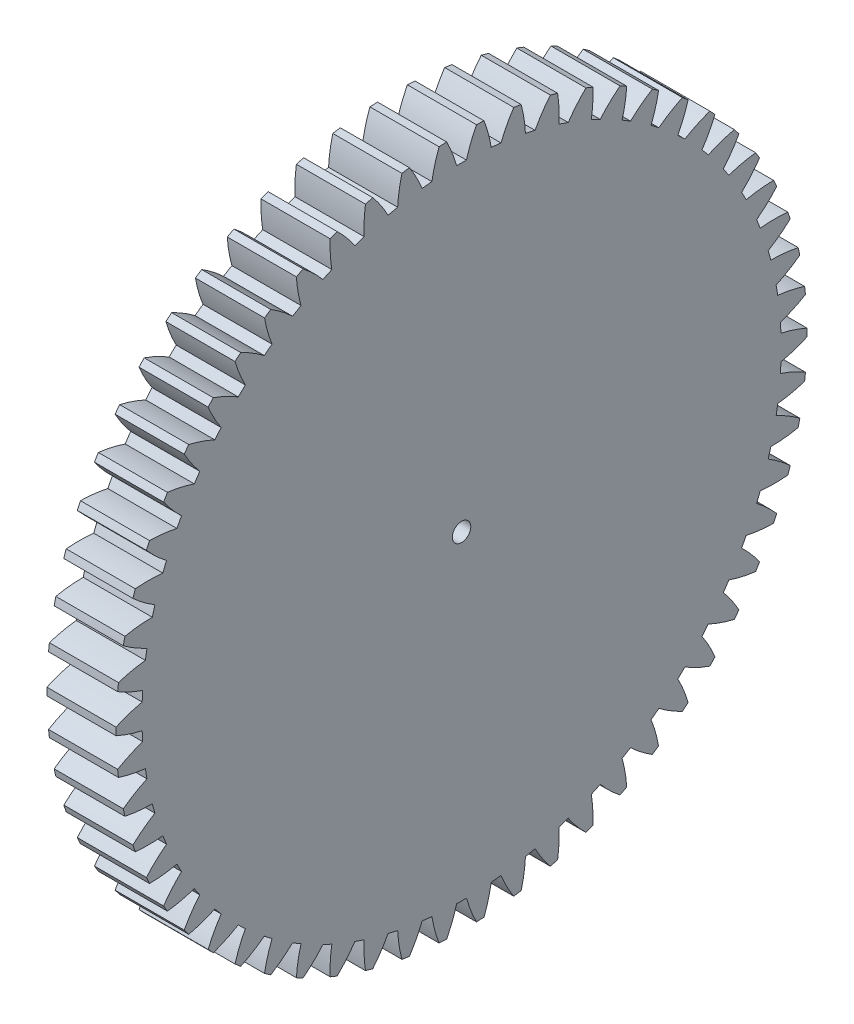
from build123d import *

# Parameters (mm, degrees)
BASPROSKE_W     = 15
BASPROSKE_H     = 75
TOOTHCUT_DEPTH  = 108.121426428
TEETHCUTS_COUNT = 58
TEETHCUTS_ANGLE = 353.793103448
BORSKE_R        = 2
BORE_DEPTH      = 50.0000508


with BuildPart() as part:
    # BasProSke → Base-Revolve (revolve)
    with BuildSketch(Plane(origin=(0, 0, 0), x_dir=(1, 0, 0), z_dir=(0, 1, 0)), mode=Mode.PRIVATE) as base_revolve_sk:
        with Locations((7.5, 37.5)):
            Rectangle(BASPROSKE_W, BASPROSKE_H)
    revolve(base_revolve_sk.sketch.rotate(Axis((-10, 0, 0), (1, 0, 0)), 180), axis=Axis((-10, 0, 0), (1, 0, 0)))

    # TooCutSke → ToothCut (cut, through all)
    with BuildSketch(Plane(origin=(0, 0, 0), x_dir=(0, 0, -1), z_dir=(1, 0, 0))):
        with BuildLine():
            ThreePointArc((1.065657476, 69.365814708), (0, 69.374), (-1.065657476, 69.365814708))
            ThreePointArc((-1.065657476, 69.365814708), (-2.015396246, 72.217083393), (-3.25511677, 74.954752084))
            ThreePointArc((-3.25511677, 74.954752084), (0, 75.0254), (3.25511677, 74.954752084))
            ThreePointArc((3.25511677, 74.954752084), (2.015396246, 72.217083393), (1.065657476, 69.365814708))
        make_face()
    toothcut = extrude(amount=TOOTHCUT_DEPTH, mode=Mode.SUBTRACT)

    # TeethCuts: ToothCut ×58 about axis
    teethcuts_axis = Axis((-10, 0, 0), (1, 0, 0))
    for i in range(1, TEETHCUTS_COUNT):
        add(toothcut.rotate(teethcuts_axis, i * TEETHCUTS_ANGLE / (TEETHCUTS_COUNT - 1)), mode=Mode.SUBTRACT)

    # BorSke → Bore (cut, symmetric)
    with BuildSketch(Plane(origin=(0, 0, 0), x_dir=(0, 0, -1), z_dir=(1, 0, 0))):
        with Locations(Location((0, 0, 0), (0, 0, 180))):
            Circle(BORSKE_R)
    extrude(amount=BORE_DEPTH, both=True, mode=Mode.SUBTRACT)


solid = part.part
